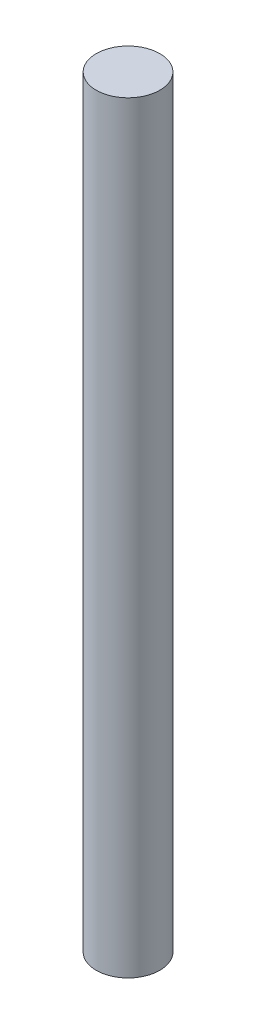
from build123d import *

# Parameters (mm, degrees)
SKETCH1_R           = 30
BOSS_EXTRUDE1_DEPTH = 720


with BuildPart() as part:
    # Sketch1 → Boss-Extrude1 (new body)
    with BuildSketch(Plane(origin=(0, 0, 0), x_dir=(1, 0, 0), z_dir=(0, 1, 0))):
        with Locations(Location((0, 0, 0), (0, 0, 90))):
            Circle(SKETCH1_R)
    extrude(amount=BOSS_EXTRUDE1_DEPTH)


solid = part.part
